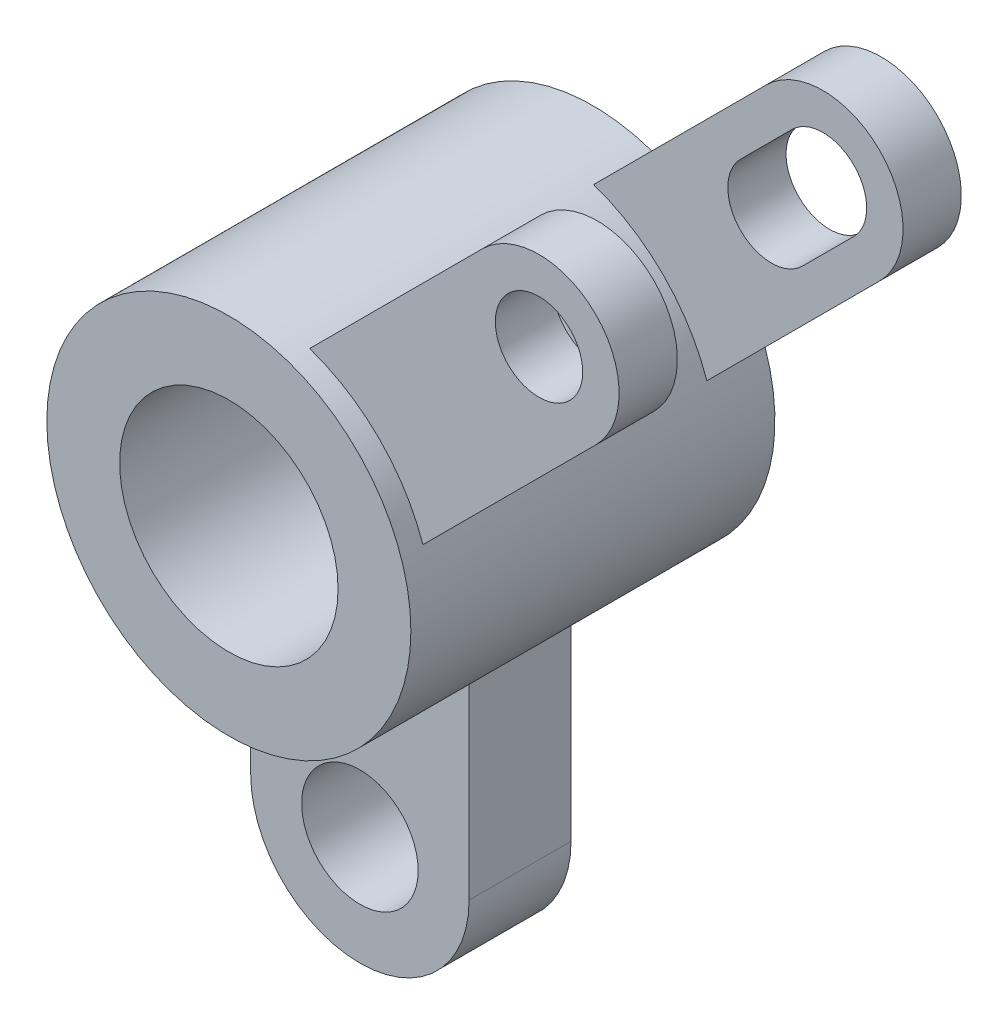
from build123d import *

# Parameters (mm, degrees)
SKETCH_1_R          = 12.5
SKETCH_1_R_2        = 7.5
EXTRUDE_1_DEPTH     = 25
SKETCH_1_4_R        = 3
EXTRUDE_3_DEPTH     = 4
EXTRUDE_START       = -4
EXTRUDE_4_DEPTH     = 4
SKETCH_3_R          = 3
CUT_EXTRUDE_1_DEPTH = 41.747119864
CUT_EXTRUDE_2_REACH = 45.647
SKETCH_5_R          = 4
EXTRUDE_5_DEPTH     = 3.5


with BuildPart() as part:
    # Эскиз1 → Бобышка-Вытянуть1 (new body)
    with BuildSketch(Plane.XY):
        Circle(SKETCH_1_R)
        Circle(SKETCH_1_R_2, mode=Mode.SUBTRACT)
    extrude(amount=EXTRUDE_1_DEPTH)

    # Эскиз1<4> → Бобышка-Вытянуть3 (add)
    with BuildSketch(Plane.XY):
        with BuildLine():
            Line((15.909902577, 23.68807717), (4.048166637, 11.82634123))
            ThreePointArc((4.048166637, 11.82634123), (8.838834765, 8.838834765), (11.82634123, 4.048166637))
            Line((11.82634123, 4.048166637), (23.68807717, 15.909902577))
            ThreePointArc((23.68807717, 15.909902577), (23.68807717, 23.68807717), (15.909902577, 23.68807717))
        make_face()
        with Locations((19.798989873, 19.798989873)):
            Circle(SKETCH_1_4_R, mode=Mode.SUBTRACT)
    extrude(amount=EXTRUDE_3_DEPTH)

    # Эскиз2 → Бобышка-Вытянуть4 (add)
    with BuildSketch(Plane.XY.offset(23.5).offset(EXTRUDE_START)):
        with BuildLine():
            Line((4.048166637, 11.82634123), (15.909902577, 23.68807717))
            ThreePointArc((15.909902577, 23.68807717), (23.68807717, 23.68807717), (23.68807717, 15.909902577))
            Line((23.68807717, 15.909902577), (11.82634123, 4.048166637))
            ThreePointArc((11.82634123, 4.048166637), (8.838834765, 8.838834765), (4.048166637, 11.82634123))
        make_face()
    extrude(amount=EXTRUDE_4_DEPTH)

    # Эскиз3 → Вырез-Вытянуть1 (cut, through all)
    with BuildSketch(Plane(origin=(0, 0, 19.5), x_dir=(-1, 0, 0), z_dir=(0, 0, -1))):
        with Locations((-19.798989873, 19.798989873)):
            Circle(SKETCH_3_R)
    extrude(amount=-CUT_EXTRUDE_1_DEPTH, mode=Mode.SUBTRACT)

    # Эскиз4 → Вырез-Вытянуть2 (cut, up to next)
    with BuildSketch(Plane(origin=(0, 0, 0), x_dir=(-1, 0, 0), z_dir=(0, 0, -1)), mode=Mode.PRIVATE) as cut_extrude_2_sk1:
        with BuildLine():
            Line((-17.67766953, 21.920310217), (-14.142135624, 18.384776311))
            ThreePointArc((-14.142135624, 18.384776311), (-14.142135624, 14.142135624), (-18.384776311, 14.142135624))
            Line((-18.384776311, 14.142135624), (-21.920310217, 17.67766953))
            ThreePointArc((-21.920310217, 17.67766953), (-21.920310217, 21.920310217), (-17.67766953, 21.920310217))
        make_face()
    cut_extrude_2_tool1 = extrude(cut_extrude_2_sk1.sketch, amount=-CUT_EXTRUDE_2_REACH, mode=Mode.PRIVATE) & part.part
    add(cut_extrude_2_tool1.solids().sort_by_distance((18.031223, 18.031223, 0))[0], mode=Mode.SUBTRACT)

    # Эскиз5 → Бобышка-Вытянуть5 (add, symmetric)
    with BuildSketch(Plane.XY.offset(12.5)):
        with BuildLine():
            Line((-7.5, -10), (-7.5, -23))
            ThreePointArc((-7.5, -23), (0, -30.5), (7.5, -23))
            Line((7.5, -23), (7.5, -10))
            Line((7.5, -10), (-7.5, -10))
        make_face()
        with Locations((0, -23)):
            Circle(SKETCH_5_R, mode=Mode.SUBTRACT)
    extrude(amount=EXTRUDE_5_DEPTH, both=True)


solid = part.part
